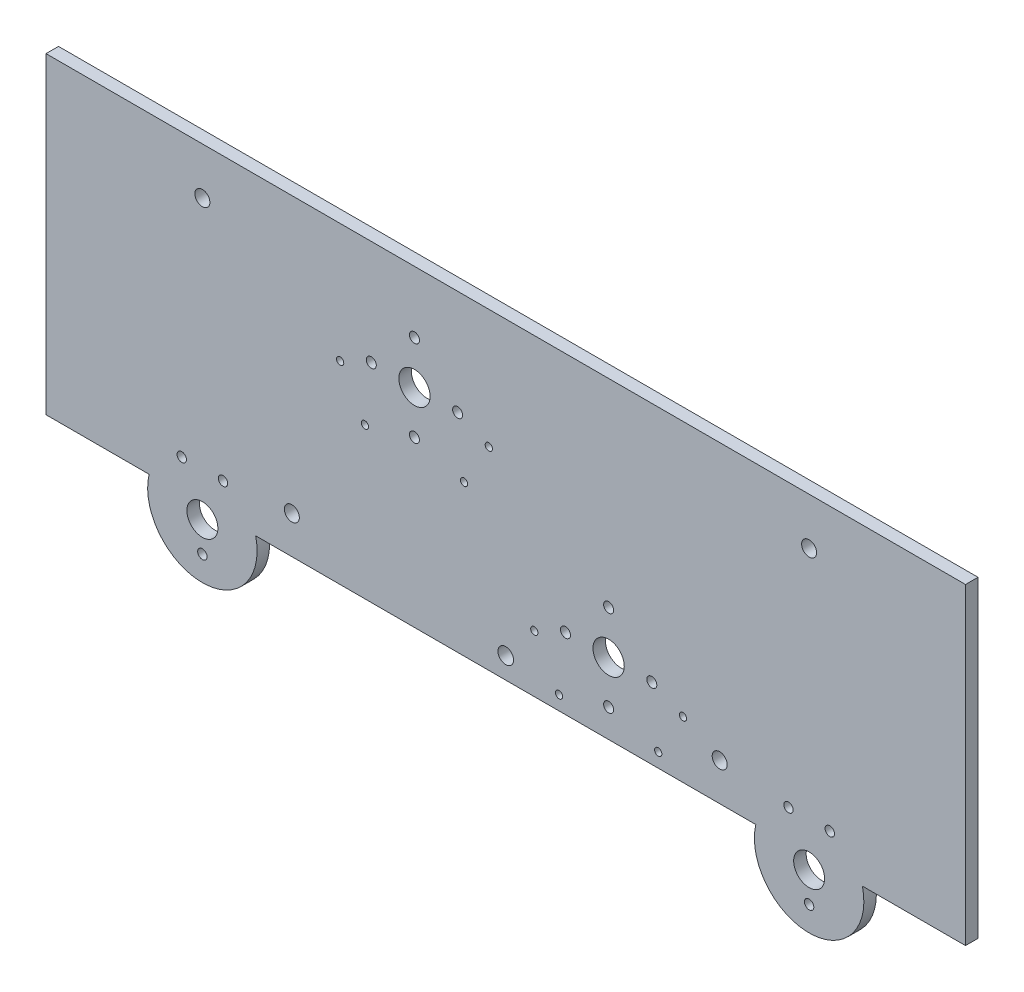
from build123d import *

# Parameters (mm, degrees)
SKETCH2_R           = 3.048
BOSS_EXTRUDE1_DEPTH = 5.07492
SKETCH2_4_R         = 6.2865
CUT_EXTRUDE11_DEPTH = 210.646067011
SKETCH3_R           = 6.35
SKETCH3_R_2         = 2.032
CUT_EXTRUDE12_DEPTH = 210.646067011
SKETCH5_R           = 1.4732
CUT_EXTRUDE13_DEPTH = 210.646067011
SKETCH7_R           = 1.905
CUT_EXTRUDE14_DEPTH = 210.646067011
SKETCH8_R           = 3.175
CUT_EXTRUDE15_DEPTH = 210.646067011


with BuildPart() as part:
    # Sketch2 → Boss-Extrude1 (new body)
    with BuildSketch(Plane.XY):
        with BuildLine():
            Line((-186.69, -31.75), (-144.826640797, -31.75))
            ThreePointArc((-144.826640797, -31.75), (-123.19, -59.055), (-101.553359203, -31.75))
            Line((-101.553359203, -31.75), (101.553359203, -31.75))
            ThreePointArc((101.553359203, -31.75), (123.19, -59.055), (144.826640797, -31.75))
            Line((144.826640797, -31.75), (186.69, -31.75))
            Line((186.69, -31.75), (186.69, 95.25))
            Line((186.69, 95.25), (-186.69, 95.25))
            Line((-186.69, 95.25), (-186.69, -31.75))
        make_face()
        with Locations((-86.868, -16.51)):
            Circle(SKETCH2_R, mode=Mode.SUBTRACT)
        with Locations((86.868, -16.51)):
            Circle(SKETCH2_R, mode=Mode.SUBTRACT)
        with Locations((123.19, 76.2)):
            Circle(SKETCH2_R, mode=Mode.SUBTRACT)
        with Locations((-123.19, 76.2)):
            Circle(SKETCH2_R, mode=Mode.SUBTRACT)
    extrude(amount=-BOSS_EXTRUDE1_DEPTH)

    # Sketch2<4> → Cut-Extrude11 (cut, through all)
    with BuildSketch(Plane.XY):
        with Locations((-123.19, -36.83)):
            Circle(SKETCH2_4_R)
        with Locations((123.19, -36.83)):
            Circle(SKETCH2_4_R)
    extrude(amount=-CUT_EXTRUDE11_DEPTH, mode=Mode.SUBTRACT)

    # Sketch3 → Cut-Extrude12 (cut, through all)
    with BuildSketch(Plane.XY):
        with Locations((-37.066912964, 52.668292248)):
            Circle(SKETCH3_R)
        with Locations((41.776586977, -2.799378671)):
            Circle(SKETCH3_R)
        with Locations((-54.592912964, 52.668292248)):
            Circle(SKETCH3_R_2)
        with Locations((-37.066912964, 70.194292248)):
            Circle(SKETCH3_R_2)
        with Locations((-37.066912964, 35.142292248)):
            Circle(SKETCH3_R_2)
        with Locations((-19.540912964, 52.668292248)):
            Circle(SKETCH3_R_2)
        with Locations((24.250586977, -2.799378671)):
            Circle(SKETCH3_R_2)
        with Locations((59.302586977, -2.799378671)):
            Circle(SKETCH3_R_2)
        with Locations((41.776586977, 14.726621329)):
            Circle(SKETCH3_R_2)
        with Locations((41.776586977, -20.325378671)):
            Circle(SKETCH3_R_2)
    extrude(amount=-CUT_EXTRUDE12_DEPTH, mode=Mode.SUBTRACT)

    # Sketch5 → Cut-Extrude13 (cut, through all)
    with BuildSketch(Plane.XY):
        with Locations((-67.25069254, 46.878801212)):
            Circle(SKETCH5_R)
        with Locations((-6.883133387, 46.878801212)):
            Circle(SKETCH5_R)
        with Locations((-57.204064287, 29.45032738)):
            Circle(SKETCH5_R)
        with Locations((-16.929761641, 29.45032738)):
            Circle(SKETCH5_R)
        with Locations((11.5928074, -8.588869707)):
            Circle(SKETCH5_R)
        with Locations((71.960366554, -8.588869707)):
            Circle(SKETCH5_R)
        with Locations((21.639435654, -26.017343538)):
            Circle(SKETCH5_R)
        with Locations((61.9137383, -26.017343538)):
            Circle(SKETCH5_R)
    extrude(amount=-CUT_EXTRUDE13_DEPTH, mode=Mode.SUBTRACT)

    # Sketch7 → Cut-Extrude14 (cut, through all)
    with BuildSketch(Plane.XY):
        with Locations((131.572, -19.05)):
            Circle(SKETCH7_R)
        with Locations((114.808, -19.05)):
            Circle(SKETCH7_R)
        with Locations((-123.19, -49.022)):
            Circle(SKETCH7_R)
        with Locations((-131.572, -19.05)):
            Circle(SKETCH7_R)
        with Locations((-114.808, -19.05)):
            Circle(SKETCH7_R)
        with Locations((123.19, -49.022)):
            Circle(SKETCH7_R)
    extrude(amount=-CUT_EXTRUDE14_DEPTH, mode=Mode.SUBTRACT)

    # Sketch8 → Cut-Extrude15 (cut, through all)
    with BuildSketch(Plane.XY):
        with Locations((0, -23.114)):
            Circle(SKETCH8_R)
    extrude(amount=-CUT_EXTRUDE15_DEPTH, mode=Mode.SUBTRACT)


solid = part.part
